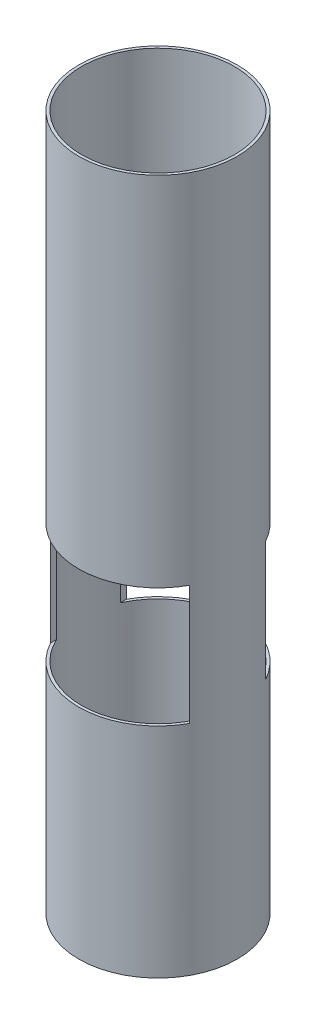
from build123d import *

# Parameters (mm, degrees)
SKETCH1_R               = 57
SKETCH1_R_2             = 55
BOSS_EXTRUDE1_DEPTH     = 500
CUT_EXTRUDE2_DEPTH      = 699.027128345
CUT_EXTRUDE2_DEPTH_BACK = 699.027128345
SKETCH2_W               = 100
SKETCH2_H               = 86


with BuildPart() as part:
    # Sketch1 → Boss-Extrude1 (new body)
    with BuildSketch(Plane(origin=(0, 0, 0), x_dir=(1, 0, 0), z_dir=(0, 1, 0))):
        with Locations(Location((0, 0, 0), (0, 0, 270))):
            Circle(SKETCH1_R)
        with Locations(Location((0, 0, 0), (0, 0, 270))):
            Circle(SKETCH1_R_2, mode=Mode.SUBTRACT)
    extrude(amount=BOSS_EXTRUDE1_DEPTH)

    # Sketch2 → Cut-Extrude2 (cut, two sides: drawn at the far end of the back side and taken through both)
    with BuildSketch(Plane(origin=(-168.932916892, 99.436512964, -468.114351188), x_dir=(1, 0, 0), z_dir=(0, 0, 1)).offset(-CUT_EXTRUDE2_DEPTH_BACK)):
        with Locations((168.932916892, 100.563487036)):
            Rectangle(SKETCH2_W, SKETCH2_H)
    extrude(amount=CUT_EXTRUDE2_DEPTH + CUT_EXTRUDE2_DEPTH_BACK, mode=Mode.SUBTRACT)


solid = part.part
